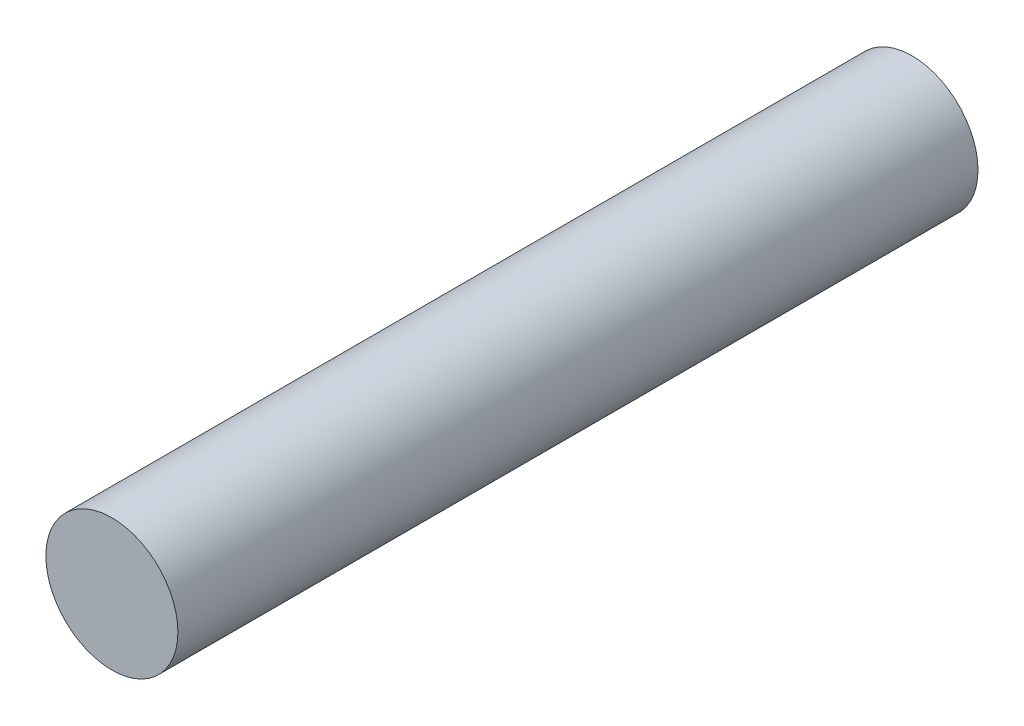
from build123d import *

# Parameters (mm, degrees)
SKIZZE1_R                       = 1.485
AUFSATZ_LINEAR_AUSTRAGEN1_DEPTH = 18


with BuildPart() as part:
    # Skizze1 → Aufsatz-Linear austragen1 (new body)
    with BuildSketch(Plane.XY):
        Circle(SKIZZE1_R)
    extrude(amount=AUFSATZ_LINEAR_AUSTRAGEN1_DEPTH)


solid = part.part
